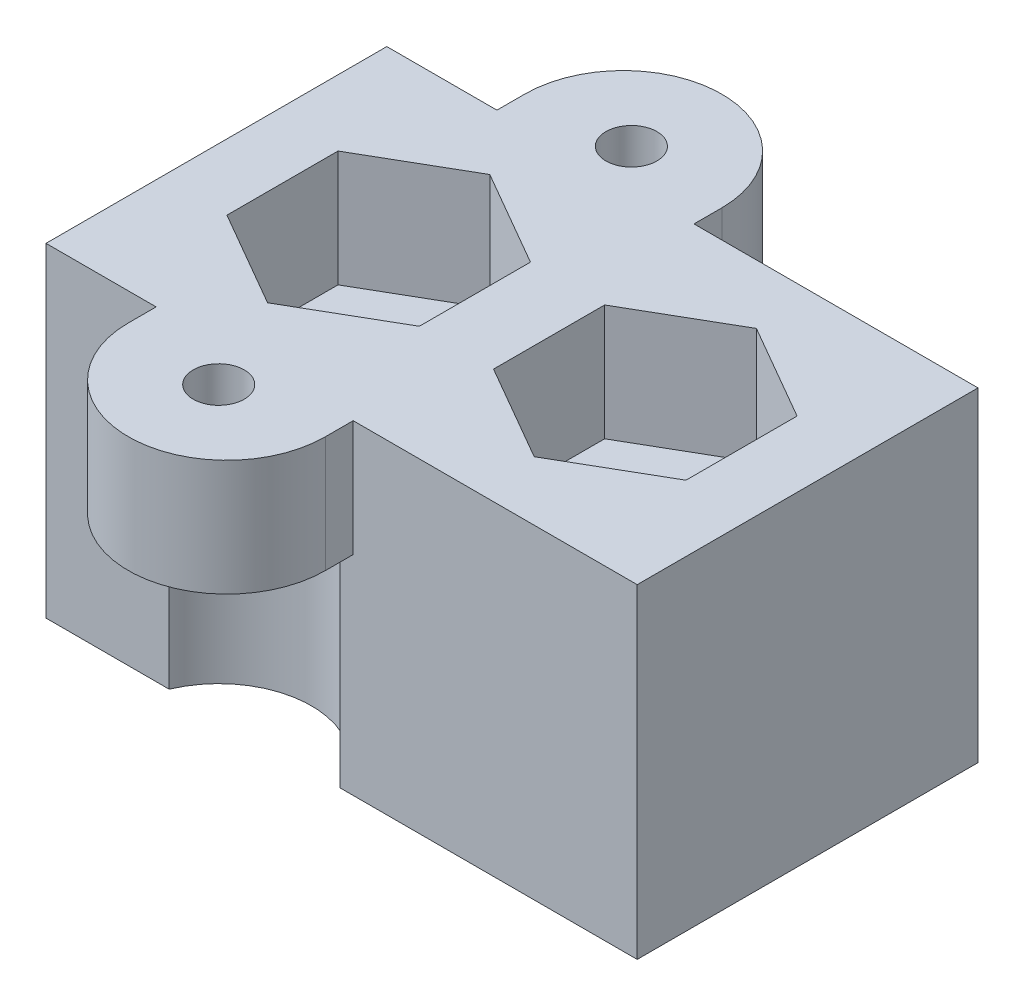
from build123d import *

# Parameters (mm, degrees)
SKETCH_1_W                    = 25.5
SKETCH_1_H                    = 14.7
EXTRUDE_415_DEPTH             = 14
SKETCH_4_W                    = 8.5
SKETCH_4_H                    = 5.45
EXTRUDE_2_DEPTH               = 5
FILLET_1_RADIUS               = 4.25
FILLET_1_LENGTH               = 5
HOLE_WIZARD_M2_1_D            = 2.2
SKETCH_7_R                    = 4
CUT_EXTRUDE_3_DEPTH           = 9
FILLET_1_OF_MIRROR_1_2_RADIUS = 4.25
FILLET_1_OF_MIRROR_1_2_LENGTH = 5
HOLE_WIZARD_M5_1_D            = 5.3
CUT_EXTRUDE_4_DEPTH           = 5


with BuildPart() as part:
    # 草图1 → Extrude 415 (new body)
    with BuildSketch(Plane(origin=(0, 0, 0), x_dir=(1, 0, 0), z_dir=(0, 1, 0))):
        with Locations((16.790583128, 0)):
            Rectangle(SKETCH_1_W, SKETCH_1_H)
    extrude(amount=EXTRUDE_415_DEPTH)

    # 草图4 → 凸台-拉伸2 (add)
    with BuildSketch(Plane.XZ.offset(-14)):
        with Locations((13.040583128, -10.075)):
            Rectangle(SKETCH_4_W, SKETCH_4_H)
    extrude_2 = extrude(amount=EXTRUDE_2_DEPTH)

    # 圆角1: full round fillet: the end face becomes a half cylinder, R = half its width
    fillet_1_face = Plane((13.040583128, 11.5, -12.8), x_dir=(0, 1, 0), z_dir=(0, 0, -1))  # on the end face: x along it, z out of the body
    fillet_1_slab = fillet_1_face.offset(-FILLET_1_RADIUS / 2) * Box(FILLET_1_LENGTH, 2 * FILLET_1_RADIUS, FILLET_1_RADIUS, mode=Mode.PRIVATE)  # the body's end, R deep
    fillet_1_round = Plane((13.040583128, 11.5, -8.55), x_dir=(0, 0, -1), z_dir=(0, 1, 0)) * Cylinder(FILLET_1_RADIUS, FILLET_1_LENGTH, mode=Mode.PRIVATE)  # its axis R under the face
    add(fillet_1_slab - fillet_1_round, mode=Mode.SUBTRACT)

    # M2 间隙孔1 (through all)
    with Locations(Plane(origin=(0, 9, 0), x_dir=(-1, 0, 0), z_dir=(0, -1, 0))):
        with Locations((-13.040583128, 8.9)):
            hole_wizard_m2_1 = Hole(HOLE_WIZARD_M2_1_D / 2)

    # 草图7 → 切除-拉伸3 (cut)
    with BuildSketch(Plane.XZ):
        with Locations((13.040583128, -8.9)):
            Circle(SKETCH_7_R)
    cut_extrude_3 = extrude(amount=-CUT_EXTRUDE_3_DEPTH, mode=Mode.SUBTRACT)

    # 镜向1: 凸台-拉伸2, M2 间隙孔1, 切除-拉伸3 across plane
    add(extrude_2.mirror(Plane.XY))
    add(hole_wizard_m2_1.mirror(Plane.XY), mode=Mode.SUBTRACT)
    add(cut_extrude_3.mirror(Plane.XY), mode=Mode.SUBTRACT)

    # 圆角1 of Mirror 1 2: full round fillet: the end face becomes a half cylinder, R = half its width
    fillet_1_of_mirror_1_2_face = Plane((13.040583128, 11.5, 12.8), x_dir=(0, 1, 0), z_dir=(0, 0, 1))  # on the end face: x along it, z out of the body
    fillet_1_of_mirror_1_2_slab = fillet_1_of_mirror_1_2_face.offset(-FILLET_1_OF_MIRROR_1_2_RADIUS / 2) * Box(FILLET_1_OF_MIRROR_1_2_LENGTH, 2 * FILLET_1_OF_MIRROR_1_2_RADIUS, FILLET_1_OF_MIRROR_1_2_RADIUS, mode=Mode.PRIVATE)  # the body's end, R deep
    fillet_1_of_mirror_1_2_round = Plane((13.040583128, 11.5, 8.55), x_dir=(0, 0, 1), z_dir=(0, 1, 0)) * Cylinder(FILLET_1_OF_MIRROR_1_2_RADIUS, FILLET_1_OF_MIRROR_1_2_LENGTH, mode=Mode.PRIVATE)  # its axis R under the face
    add(fillet_1_of_mirror_1_2_slab - fillet_1_of_mirror_1_2_round, mode=Mode.SUBTRACT)

    # M5 间隙孔1 (through all)
    with Locations(Plane(origin=(0, 0, 0), x_dir=(-1, 0, 0), z_dir=(0, -1, 0))):
        with Locations((-22.540583128, 0), (-11.040583128, 0)):
            Hole(HOLE_WIZARD_M5_1_D / 2)

    # 草图10 → 切除-拉伸4 (cut)
    with BuildSketch(Plane(origin=(0, 14, 0), x_dir=(1, 0, 0), z_dir=(0, 1, 0))):
        Polygon((11.040583128, 4.792007234), (6.890583128, 2.396003617), (6.890583128, -2.396003617), (11.040583128, -4.792007234), (15.190583128, -2.396003617), (15.190583128, 2.396003617), align=None)
        Polygon((22.540583128, 4.792007234), (18.390583128, 2.396003617), (18.390583128, -2.396003617), (22.540583128, -4.792007234), (26.690583128, -2.396003617), (26.690583128, 2.396003617), align=None)
    extrude(amount=-CUT_EXTRUDE_4_DEPTH, mode=Mode.SUBTRACT)


solid = part.part
